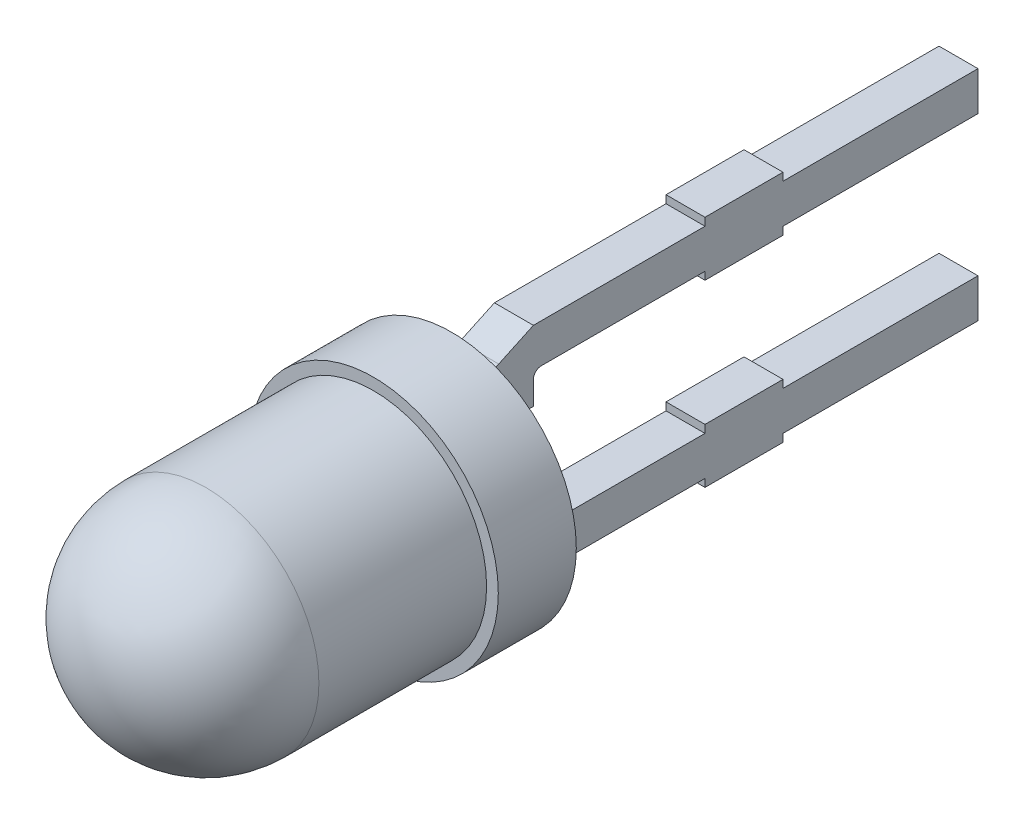
from build123d import *

# Parameters (mm, degrees)
EXTRUDE1_DEPTH          = 0.25
FILLET1_R               = 0.25
CUT_EXTRUDE1_DEPTH      = 31.234789562
CUT_EXTRUDE1_DEPTH_BACK = 31.234789562
SKETCH3_W               = 12.882415547
SKETCH3_H               = 2.8
CUT_EXTRUDE2_DEPTH      = 19.290502996
CUT_EXTRUDE2_DEPTH_BACK = 19.290502996
SKETCH4_W               = 11.746427447
SKETCH4_H               = 5.813888333


with BuildPart() as part:
    # Sketch1 → Revolve1 (revolve)
    with BuildSketch(Plane(origin=(0, 0, 0), x_dir=(0, 0, -1), z_dir=(1, 0, 0)), mode=Mode.PRIVATE) as revolve1_sk:
        with BuildLine():
            Line((0, 1.45), (2.15, 1.45))
            Line((2.15, 1.45), (2.15, 1.599999975))
            Line((2.15, 1.599999975), (3.15, 1.599999975))
            Line((3.15, 1.599999975), (3.15, 0))
            Line((3.15, 0), (-1.45, 0))
            ThreePointArc((-1.45, 0), (-1.025304833, 1.025304833), (0, 1.45))
        make_face()
    revolve(revolve1_sk.sketch.rotate(Axis((0, 0, 0), (0, 0, -1)), 90), axis=Axis((0, 0, 0), (0, 0, -1)))

    # Sketch2 → Extrude1 (add, symmetric)
    with BuildSketch(Plane(origin=(0, 0, 0), x_dir=(0, 0, -1), z_dir=(1, 0, 0))):
        with BuildLine():
            Line((3.15, 1.026953873), (3.95, 1.4))
            Line((3.95, 1.4), (6.15, 1.4))
            Line((6.15, 1.4), (6.15, 1.5))
            Line((6.15, 1.5), (7.15, 1.5))
            Line((7.15, 1.5), (7.15, 1.4))
            Line((7.15, 1.4), (30.15, 1.4))
            Line((30.15, 1.4), (30.15, 0.9))
            Line((30.15, 0.9), (7.15, 0.9))
            Line((7.15, 0.9), (7.15, 0.8))
            Line((7.15, 0.8), (6.15, 0.8))
            Line((6.15, 0.8), (6.15, 0.9))
            Line((6.15, 0.9), (4.05, 0.9))
            ThreePointArc((4.05, 0.9), (3.979289322, 0.870710678), (3.95, 0.8))
            Line((3.95, 0.8), (3.95, 0.5))
            Line((3.95, 0.5), (3.15, 0.5))
            Line((3.15, 0.5), (3.15, 1.026953873))
        make_face()
        with BuildLine():
            Line((3.95, -0.8), (3.95, -0.5))
            Line((3.95, -0.5), (3.15, -0.5))
            Line((3.15, -0.5), (3.15, -1.026953873))
            Line((3.15, -1.026953873), (3.95, -1.4))
            Line((3.95, -1.4), (6.15, -1.4))
            Line((6.15, -1.4), (6.15, -1.5))
            Line((6.15, -1.5), (7.15, -1.5))
            Line((7.15, -1.5), (7.15, -1.4))
            Line((7.15, -1.4), (30.15, -1.4))
            Line((30.15, -1.4), (30.15, -0.9))
            Line((30.15, -0.9), (7.15, -0.9))
            Line((7.15, -0.9), (7.15, -0.8))
            Line((7.15, -0.8), (6.15, -0.8))
            Line((6.15, -0.8), (6.15, -0.9))
            Line((6.15, -0.9), (4.05, -0.9))
            ThreePointArc((4.05, -0.9), (3.979289322, -0.870710678), (3.95, -0.8))
        make_face()
    extrude(amount=EXTRUDE1_DEPTH, both=True)

    # Fillet1
    fillet1_edges = [part.edges().sort_by_distance(p)[0] for p in [
        (-0.25, 0.763476937, -3.15),
        (0, 1.026953873, -3.15),
        (0, 0.5, -3.15),
        (0.25, 0.763476937, -3.15),
        (-0.25, -0.763476937, -3.15),
        (0, -0.5, -3.15),
        (0, -1.026953873, -3.15),
        (0.25, -0.763476937, -3.15),
    ]]
    fillet(fillet1_edges, radius=FILLET1_R)

    # Sketch3 → Cut-Extrude1 (cut, two sides: drawn at the far end of the back side and taken through both)
    with BuildSketch(Plane(origin=(0, 0, 0), x_dir=(0, 0, -1), z_dir=(1, 0, 0)).offset(-CUT_EXTRUDE1_DEPTH_BACK)):
        with Locations((24.591207774, 0)):
            Rectangle(SKETCH3_W, SKETCH3_H)
    extrude(amount=CUT_EXTRUDE1_DEPTH + CUT_EXTRUDE1_DEPTH_BACK, mode=Mode.SUBTRACT)

    # Sketch4 → Cut-Extrude2 (cut, two sides: drawn at the far end of the back side and taken through both)
    with BuildSketch(Plane(origin=(0, 0, 0), x_dir=(0, 0, -1), z_dir=(1, 0, 0)).offset(-CUT_EXTRUDE2_DEPTH_BACK)):
        with Locations((15.523213723, 0.186451229)):
            Rectangle(SKETCH4_W, SKETCH4_H)
    extrude(amount=CUT_EXTRUDE2_DEPTH + CUT_EXTRUDE2_DEPTH_BACK, mode=Mode.SUBTRACT)


solid = part.part
